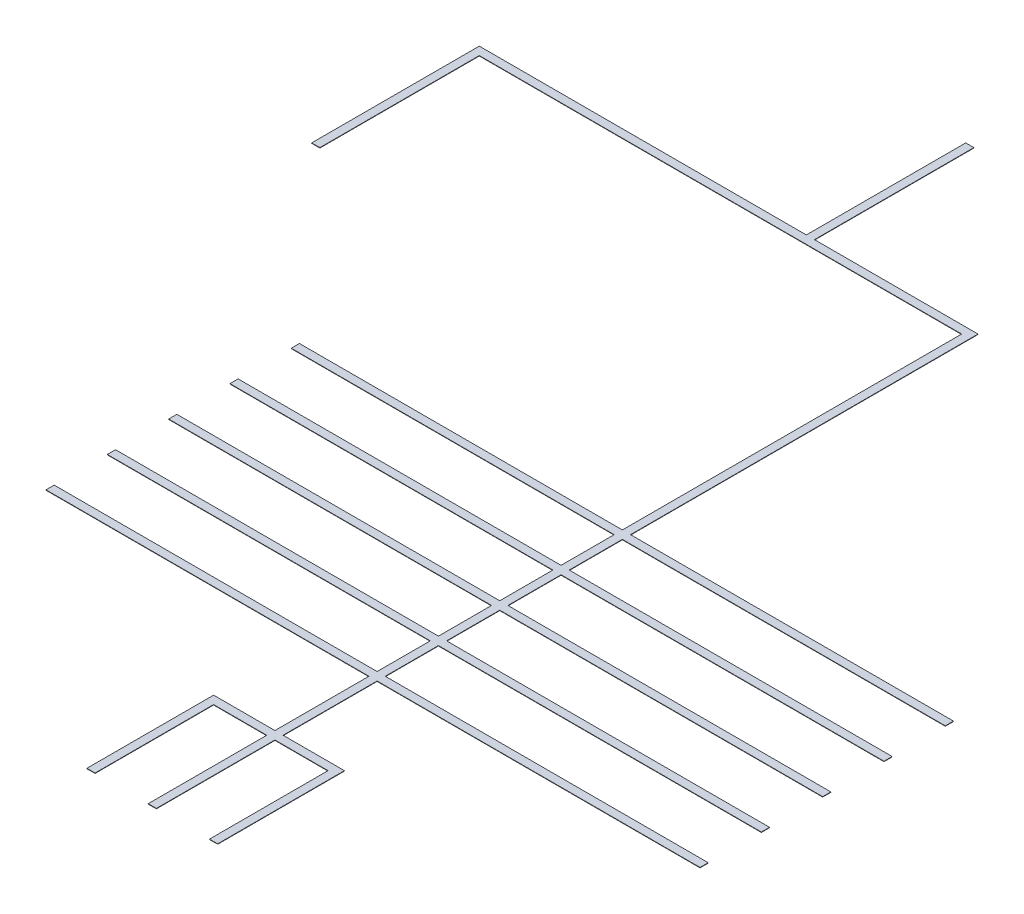
from build123d import *

# Parameters (mm, degrees)
EXTRUDE_1_DEPTH = 1


with BuildPart() as part:
    # 草图2 → 凸台-拉伸1 (new body)
    with BuildSketch(Plane(origin=(0, 0, 0), x_dir=(1, 0, 0), z_dir=(0, 1, 0))):
        Polygon((-1189.375295585, 399.687647792), (-1189.375295585, 789.687647792), (-9.375295585, 789.687647792), (-9.375295585, -40.312352208), (-799.375295585, -40.312352208), (-799.375295585, -60.312352208), (-9.375295585, -60.312352208), (-9.375295585, -190.312352208), (-799.375295585, -190.312352208), (-799.375295585, -210.312352208), (-9.375295585, -210.312352208), (-9.375295585, -340.312352208), (-799.375295585, -340.312352208), (-799.375295585, -360.312352208), (-9.375295585, -360.312352208), (-9.375295585, -490.312352208), (-799.375295585, -490.312352208), (-799.375295585, -510.312352208), (-9.375295585, -510.312352208), (-9.375295585, -640.312352208), (-799.375295585, -640.312352208), (-799.375295585, -660.312352208), (-9.375295585, -660.312352208), (-9.375295585, -890.312352208), (-159.375295585, -890.312352208), (-159.375295585, -1200.312352208), (-139.375295585, -1200.312352208), (-139.375295585, -910.312352208), (-9.375295585, -910.312352208), (-9.375295585, -1200.312352208), (10.624704415, -1200.312352208), (10.624704415, -910.312352208), (140.624704415, -910.312352208), (140.624704415, -1200.312352208), (160.624704415, -1200.312352208), (160.624704415, -890.312352208), (10.624704415, -890.312352208), (10.624704415, -660.312352208), (800.624704415, -660.312352208), (800.624704415, -640.312352208), (10.624704415, -640.312352208), (10.624704415, -510.312352208), (800.624704415, -510.312352208), (800.624704415, -490.312352208), (10.624704415, -490.312352208), (10.624704415, -360.312352208), (800.624704415, -360.312352208), (800.624704415, -340.312352208), (10.624704415, -340.312352208), (10.624704415, -210.312352208), (800.624704415, -210.312352208), (800.624704415, -190.312352208), (10.624704415, -190.312352208), (10.624704415, -60.312352208), (800.624704415, -60.312352208), (800.624704415, -40.312352208), (10.624704415, -40.312352208), (10.624704415, 799.687647792), (10.624704415, 809.687647792), (-389.375295585, 809.687647792), (-389.375295585, 1199.687647792), (-409.375295585, 1199.687647792), (-409.375295585, 809.687647792), (-1209.375295585, 809.687647792), (-1209.375295585, 399.687647792), align=None)
    extrude(amount=EXTRUDE_1_DEPTH)


solid = part.part
